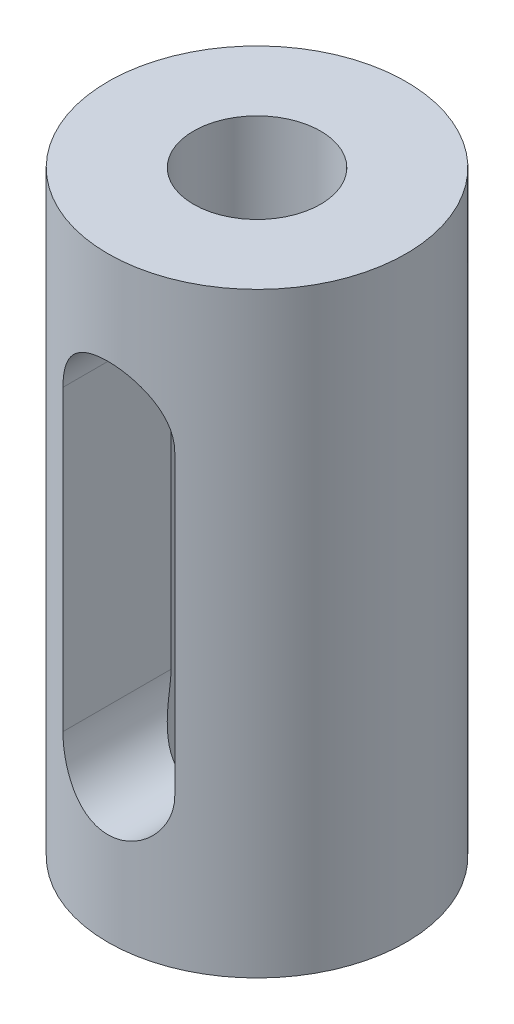
from build123d import *

# Parameters (mm, degrees)
SKETCH1_R                 = 3.175
BOSS_EXTRUDE1_DEPTH       = 12.7
TAP_DRILL_FOR_6_32_TAP1_D = 2.7051
CUT_EXTRUDE1_DEPTH        = 14.470384182
CUT_EXTRUDE1_DEPTH_BACK   = 14.470384182


with BuildPart() as part:
    # Sketch1 → Boss-Extrude1 (new body)
    with BuildSketch(Plane(origin=(0, 0, 0), x_dir=(1, 0, 0), z_dir=(0, 1, 0))):
        with Locations(Location((0, 0, 0), (0, 0, 270))):
            Circle(SKETCH1_R)
    extrude(amount=BOSS_EXTRUDE1_DEPTH)

    # Tap Drill for #6-32 Tap1 (through all)
    with Locations(Plane(origin=(0, 12.7, 0), x_dir=(1, 0, 0), z_dir=(0, 1, 0))):
        with Locations((0, 0)):
            Hole(TAP_DRILL_FOR_6_32_TAP1_D / 2)

    # Sketch4 → Cut-Extrude1 (cut, two sides: drawn at the far end of the back side and taken through both)
    with BuildSketch(Plane.XY.offset(-CUT_EXTRUDE1_DEPTH_BACK)):
        with BuildLine():
            Line((1.190625, 9.525), (1.190625, 3.175))
            ThreePointArc((1.190625, 3.175), (0, 1.984375), (-1.190625, 3.175))
            Line((-1.190625, 3.175), (-1.190625, 9.525))
            ThreePointArc((-1.190625, 9.525), (0, 10.715625), (1.190625, 9.525))
        make_face()
    extrude(amount=CUT_EXTRUDE1_DEPTH + CUT_EXTRUDE1_DEPTH_BACK, mode=Mode.SUBTRACT)


solid = part.part
